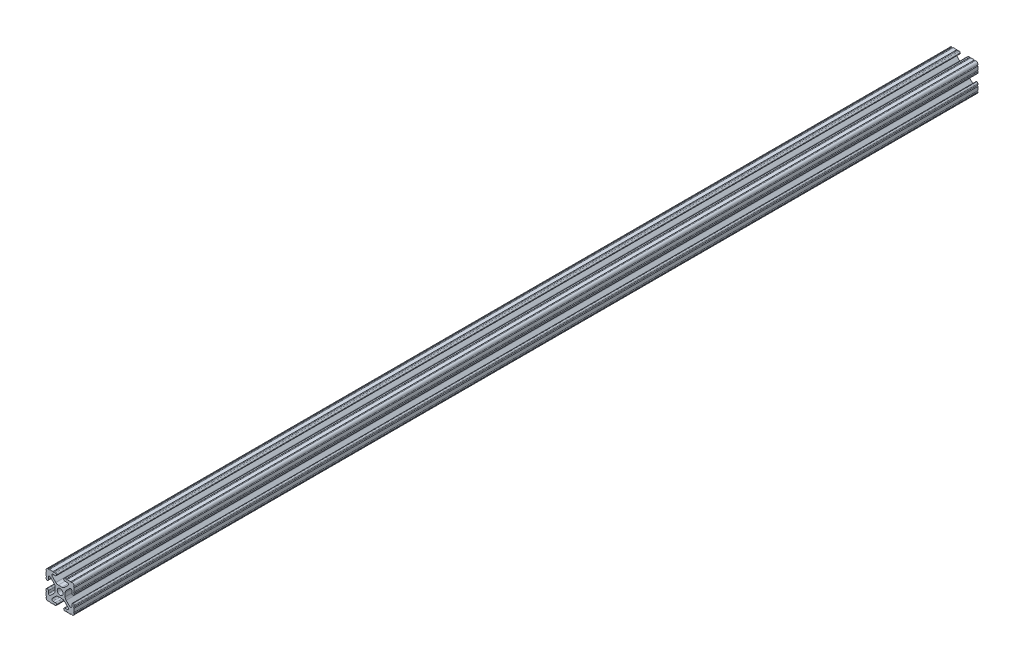
from build123d import *

# Parameters (mm, degrees)
SKETCH1_R           = 2.6035
BOSS_EXTRUDE1_DEPTH = 406.4


with BuildPart() as part:
    # Sketch1 → Boss-Extrude1 (new, symmetric)
    with BuildSketch(Plane.XY):
        with BuildLine():
            Line((-7.179650497, -8.645192506), (-3.952270251, -5.423690499))
            ThreePointArc((-3.952270251, -5.423690499), (-2.922936451, -4.736929036), (-1.709253557, -4.4958))
            Line((-1.709253557, -4.4958), (1.709253557, -4.4958))
            ThreePointArc((1.709253557, -4.4958), (2.922936451, -4.736929036), (3.952270251, -5.423690499))
            Line((3.952270251, -5.423690499), (7.179650497, -8.645192506))
            ThreePointArc((7.179650497, -8.645192506), (7.41473083, -9.822813117), (6.416408329, -10.4902))
            Line((6.416408329, -10.4902), (4.287512407, -10.4902))
            ThreePointArc((4.287512407, -10.4902), (3.54574862, -10.79744862), (3.2385, -11.539212407))
            Line((3.2385, -11.539212407), (3.2385, -11.650987593))
            ThreePointArc((3.2385, -11.650987593), (3.54574862, -12.39275138), (4.287512407, -12.7))
            Line((4.287512407, -12.7), (5.317126718, -12.7))
            ThreePointArc((5.317126718, -12.7), (5.825126718, -12.192), (6.333126718, -12.7))
            Line((6.333126718, -12.7), (9.550443118, -12.7))
            ThreePointArc((9.550443118, -12.7), (10.058366869, -12.192000006), (10.566443095, -12.699847501))
            ThreePointArc((10.566443095, -12.699847501), (12.082537762, -12.08250727), (12.699846982, -10.566399977))
            ThreePointArc((12.699846982, -10.566399977), (12.192000006, -10.058323491), (12.7, -9.5504))
            Line((12.7, -9.5504), (12.7, -6.3330836))
            ThreePointArc((12.7, -6.3330836), (12.192, -5.8250836), (12.7, -5.3170836))
            Line((12.7, -5.3170836), (12.7, -4.287469289))
            ThreePointArc((12.7, -4.287469289), (12.39275138, -3.545705502), (11.650987593, -3.238456882))
            Line((11.650987593, -3.238456882), (11.539212407, -3.238456882))
            ThreePointArc((11.539212407, -3.238456882), (10.79744862, -3.545705502), (10.4902, -4.287469289))
            Line((10.4902, -4.287469289), (10.4902, -6.402089023))
            ThreePointArc((10.4902, -6.402089023), (9.856505071, -7.351067942), (8.737131347, -7.129408934))
            Line((8.737131347, -7.129408934), (5.441005833, -3.840816462))
            ThreePointArc((5.441005833, -3.840816462), (4.750877967, -2.809883091), (4.5085, -1.593185507))
            Line((4.5085, -1.593185507), (4.5085, 1.593185507))
            ThreePointArc((4.5085, 1.593185507), (4.750877967, 2.809883091), (5.441005833, 3.840816462))
            Line((5.441005833, 3.840816462), (8.737131347, 7.129408934))
            ThreePointArc((8.737131347, 7.129408934), (9.856505071, 7.351067942), (10.4902, 6.402089023))
            Line((10.4902, 6.402089023), (10.4902, 4.287469289))
            ThreePointArc((10.4902, 4.287469289), (10.79744862, 3.545705502), (11.539212407, 3.238456882))
            Line((11.539212407, 3.238456882), (11.650987593, 3.238456882))
            ThreePointArc((11.650987593, 3.238456882), (12.39275138, 3.545705502), (12.7, 4.287469289))
            Line((12.7, 4.287469289), (12.7, 5.3170836))
            ThreePointArc((12.7, 5.3170836), (12.192, 5.8250836), (12.7, 6.3330836))
            Line((12.7, 6.3330836), (12.7, 9.5504))
            ThreePointArc((12.7, 9.5504), (12.192000006, 10.058323491), (12.699846982, 10.566399977))
            ThreePointArc((12.699846982, 10.566399977), (12.082537762, 12.08250727), (10.566443095, 12.699847501))
            ThreePointArc((10.566443095, 12.699847501), (10.058366869, 12.192000006), (9.550443118, 12.7))
            Line((9.550443118, 12.7), (6.333126718, 12.7))
            ThreePointArc((6.333126718, 12.7), (5.825126718, 12.192), (5.317126718, 12.7))
            Line((5.317126718, 12.7), (4.287512407, 12.7))
            ThreePointArc((4.287512407, 12.7), (3.54574862, 12.39275138), (3.2385, 11.650987593))
            Line((3.2385, 11.650987593), (3.2385, 11.539212407))
            ThreePointArc((3.2385, 11.539212407), (3.54574862, 10.79744862), (4.287512407, 10.4902))
            Line((4.287512407, 10.4902), (6.476788598, 10.4902))
            ThreePointArc((6.476788598, 10.4902), (7.432222385, 9.85140422), (7.207036008, 8.724370562))
            Line((7.207036008, 8.724370562), (3.898272566, 5.423169045))
            ThreePointArc((3.898272566, 5.423169045), (2.869120213, 4.736787962), (1.655778399, 4.4958))
            Line((1.655778399, 4.4958), (-1.655778399, 4.4958))
            ThreePointArc((-1.655778399, 4.4958), (-2.869120213, 4.736787962), (-3.898272566, 5.423169045))
            Line((-3.898272566, 5.423169045), (-7.207036008, 8.724370562))
            ThreePointArc((-7.207036008, 8.724370562), (-7.432222385, 9.85140422), (-6.476788598, 10.4902))
            Line((-6.476788598, 10.4902), (-4.287512407, 10.4902))
            ThreePointArc((-4.287512407, 10.4902), (-3.54574862, 10.79744862), (-3.2385, 11.539212407))
            Line((-3.2385, 11.539212407), (-3.2385, 11.650987593))
            ThreePointArc((-3.2385, 11.650987593), (-3.54574862, 12.39275138), (-4.287512407, 12.7))
            Line((-4.287512407, 12.7), (-5.317126718, 12.7))
            ThreePointArc((-5.317126718, 12.7), (-5.825126718, 12.192), (-6.333126718, 12.7))
            Line((-6.333126718, 12.7), (-9.550443118, 12.7))
            ThreePointArc((-9.550443118, 12.7), (-10.058366869, 12.192000006), (-10.566443095, 12.699847501))
            ThreePointArc((-10.566443095, 12.699847501), (-12.082537762, 12.08250727), (-12.699846982, 10.566399977))
            ThreePointArc((-12.699846982, 10.566399977), (-12.192000006, 10.058323491), (-12.7, 9.5504))
            Line((-12.7, 9.5504), (-12.7, 6.3330836))
            ThreePointArc((-12.7, 6.3330836), (-12.192, 5.8250836), (-12.7, 5.3170836))
            Line((-12.7, 5.3170836), (-12.7, 4.287469289))
            ThreePointArc((-12.7, 4.287469289), (-12.39275138, 3.545705502), (-11.650987593, 3.238456882))
            Line((-11.650987593, 3.238456882), (-11.539212407, 3.238456882))
            ThreePointArc((-11.539212407, 3.238456882), (-10.79744862, 3.545705502), (-10.4902, 4.287469289))
            Line((-10.4902, 4.287469289), (-10.4902, 6.402089023))
            ThreePointArc((-10.4902, 6.402089023), (-9.856505071, 7.351067942), (-8.737131347, 7.129408934))
            Line((-8.737131347, 7.129408934), (-5.441005833, 3.840816462))
            ThreePointArc((-5.441005833, 3.840816462), (-4.750877967, 2.809883091), (-4.5085, 1.593185507))
            Line((-4.5085, 1.593185507), (-4.5085, -1.593185507))
            ThreePointArc((-4.5085, -1.593185507), (-4.750877967, -2.809883091), (-5.441005833, -3.840816462))
            Line((-5.441005833, -3.840816462), (-8.737131347, -7.129408934))
            ThreePointArc((-8.737131347, -7.129408934), (-9.856505071, -7.351067942), (-10.4902, -6.402089023))
            Line((-10.4902, -6.402089023), (-10.4902, -4.287469289))
            ThreePointArc((-10.4902, -4.287469289), (-10.79744862, -3.545705502), (-11.539212407, -3.238456882))
            Line((-11.539212407, -3.238456882), (-11.650987593, -3.238456882))
            ThreePointArc((-11.650987593, -3.238456882), (-12.39275138, -3.545705502), (-12.7, -4.287469289))
            Line((-12.7, -4.287469289), (-12.7, -5.3170836))
            ThreePointArc((-12.7, -5.3170836), (-12.192, -5.8250836), (-12.7, -6.3330836))
            Line((-12.7, -6.3330836), (-12.7, -9.5504))
            ThreePointArc((-12.7, -9.5504), (-12.192000006, -10.058323491), (-12.699846982, -10.566399977))
            ThreePointArc((-12.699846982, -10.566399977), (-12.082537762, -12.08250727), (-10.566443095, -12.699847501))
            ThreePointArc((-10.566443095, -12.699847501), (-10.058366869, -12.192000006), (-9.550443118, -12.7))
            Line((-9.550443118, -12.7), (-6.333126718, -12.7))
            ThreePointArc((-6.333126718, -12.7), (-5.825126718, -12.192), (-5.317126718, -12.7))
            Line((-5.317126718, -12.7), (-4.287512407, -12.7))
            ThreePointArc((-4.287512407, -12.7), (-3.54574862, -12.39275138), (-3.2385, -11.650987593))
            Line((-3.2385, -11.650987593), (-3.2385, -11.539212407))
            ThreePointArc((-3.2385, -11.539212407), (-3.54574862, -10.79744862), (-4.287512407, -10.4902))
            Line((-4.287512407, -10.4902), (-6.416408329, -10.4902))
            ThreePointArc((-6.416408329, -10.4902), (-7.41473083, -9.822813117), (-7.179650497, -8.645192506))
        make_face()
        Circle(SKETCH1_R, mode=Mode.SUBTRACT)
    extrude(amount=BOSS_EXTRUDE1_DEPTH, both=True)


solid = part.part
